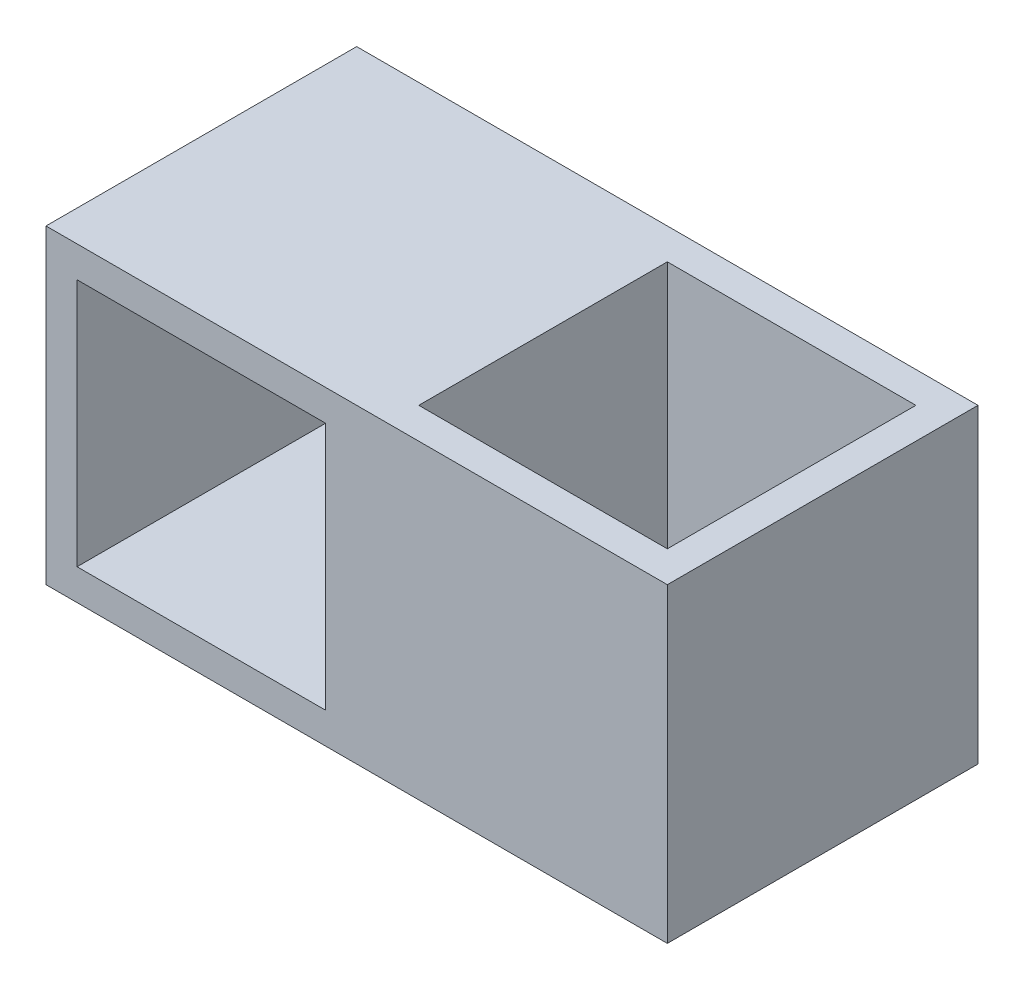
from build123d import *

# Parameters (mm, degrees)
SKETCH1_W           = 100
SKETCH1_H           = 50
BOSS_EXTRUDE1_DEPTH = 50
CUT_EXTRUDE1_REACH  = 88.603
SKETCH2_W           = 40
SKETCH2_H           = 40
CUT_EXTRUDE2_REACH  = 77
SKETCH3_W           = 40
SKETCH3_H           = 40


with BuildPart() as part:
    # Sketch1 → Boss-Extrude1 (new body)
    with BuildSketch(Plane.XY):
        Rectangle(SKETCH1_W, SKETCH1_H)
    extrude(amount=BOSS_EXTRUDE1_DEPTH)

    # Sketch2 → Cut-Extrude1 (cut, up to next)
    with BuildSketch(Plane.XZ.offset(25), mode=Mode.PRIVATE) as cut_extrude1_sk1:
        with Locations((25, 25)):
            Rectangle(SKETCH2_W, SKETCH2_H)
    cut_extrude1_tool1 = extrude(cut_extrude1_sk1.sketch, amount=-CUT_EXTRUDE1_REACH, mode=Mode.PRIVATE) & part.part
    add(cut_extrude1_tool1.solids().sort_by_distance((25, -25, 25))[0], mode=Mode.SUBTRACT)

    # Sketch3 → Cut-Extrude2 (cut, up to next)
    with BuildSketch(Plane.XY.offset(50), mode=Mode.PRIVATE) as cut_extrude2_sk1:
        with Locations((-25, 0)):
            Rectangle(SKETCH3_W, SKETCH3_H)
    cut_extrude2_tool1 = extrude(cut_extrude2_sk1.sketch, amount=-CUT_EXTRUDE2_REACH, mode=Mode.PRIVATE) & part.part
    add(cut_extrude2_tool1.solids().sort_by_distance((-25, 0, 50))[0], mode=Mode.SUBTRACT)


solid = part.part
